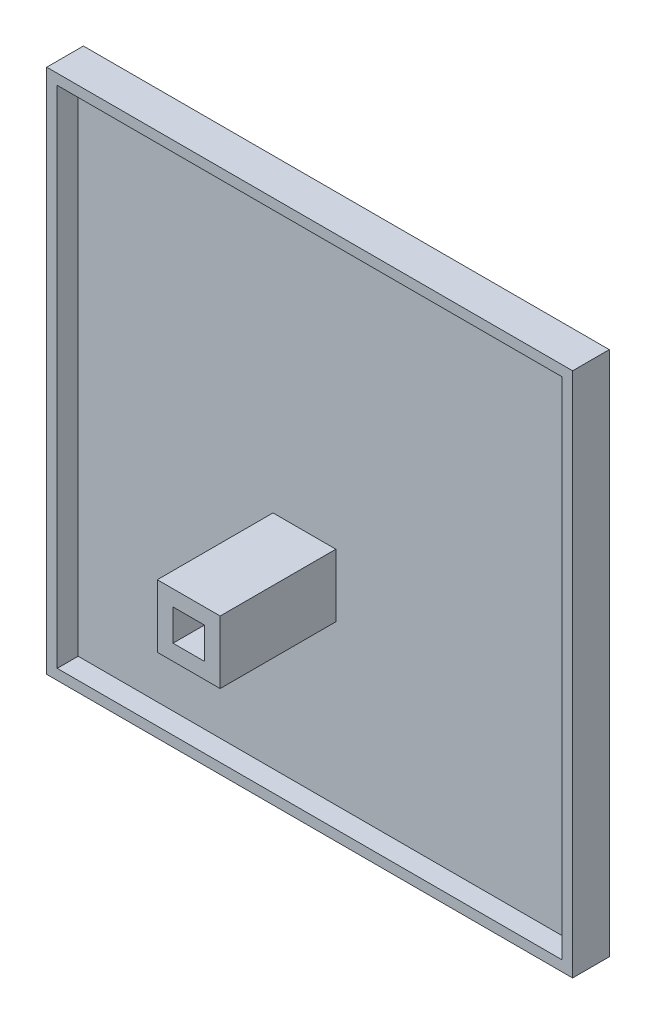
from build123d import *

# Parameters (mm, degrees)
SKETCH_1_W          = 100.4
SKETCH_1_H          = 100.4
EXTRUDE_2_DEPTH     = 2
SKETCH_2_W          = 100.4
SKETCH_2_H          = 2
EXTRUDE_3_DEPTH     = 4
SKETCH_3_W          = 2
SKETCH_3_H          = 96.4
EXTRUDE_4_DEPTH     = 4
SKETCH_4_W          = 12
SKETCH_4_H          = 12
EXTRUDE_5_DEPTH     = 22.09
SKETCH_7_W          = 6
SKETCH_7_H          = 6
CUT_EXTRUDE_1_DEPTH = 22.09
SKETCH_8_W          = 6
SKETCH_8_H          = 6
EXTRUDE_6_DEPTH     = 2
SKETCH_10_W         = 100.4
SKETCH_10_H         = 100.4
EXTRUDE_7_DEPTH     = 1


with BuildPart() as part:
    # 草圖1 → 填料-伸長2 (new body)
    with BuildSketch(Plane.XY):
        with Locations((50.2, -50.2)):
            Rectangle(SKETCH_1_W, SKETCH_1_H)
    extrude(amount=EXTRUDE_2_DEPTH)

    # 草圖2 → 填料-伸長3 (add)
    with BuildSketch(Plane.XY.offset(2)):
        Polygon((100.4, -2), (100.4, 0), (0, 0), (0, -2), (1, -2), (55.6, -2), align=None)
        with Locations((50.2, -99.4)):
            Rectangle(SKETCH_2_W, SKETCH_2_H)
    extrude(amount=EXTRUDE_3_DEPTH)

    # 草圖3 → 填料-伸長4 (add)
    with BuildSketch(Plane.XY.offset(2)):
        with Locations((1, -50.2)):
            Rectangle(SKETCH_3_W, SKETCH_3_H)
        with Locations((99.4, -50.2)):
            Rectangle(SKETCH_3_W, SKETCH_3_H)
    extrude(amount=EXTRUDE_4_DEPTH)

    # 草圖4 → 填料-伸長5 (add)
    with BuildSketch(Plane.XY.offset(2)):
        with Locations((45.2, -62.1)):
            Rectangle(SKETCH_4_W, SKETCH_4_H)
    extrude(amount=EXTRUDE_5_DEPTH)

    # 草圖7 → 除料-伸長1 (cut)
    with BuildSketch(Plane.XY.offset(24.09)):
        with Locations((45.2, -62.1)):
            Rectangle(SKETCH_7_W, SKETCH_7_H)
    extrude(amount=-CUT_EXTRUDE_1_DEPTH, mode=Mode.SUBTRACT)

    # 草圖8 → 填料-伸長6 (add)
    with BuildSketch(Plane.XY.offset(2)):
        with Locations((45.2, -62.1)):
            Rectangle(SKETCH_8_W, SKETCH_8_H)
    extrude(amount=EXTRUDE_6_DEPTH)

    # 草圖10 → 填料-伸長7 (add)
    with BuildSketch(Plane(origin=(0, 0, 0), x_dir=(-1, 0, 0), z_dir=(0, 0, -1))):
        with Locations((-50.2, -50.2)):
            Rectangle(SKETCH_10_W, SKETCH_10_H)
    extrude(amount=EXTRUDE_7_DEPTH)


solid = part.part
